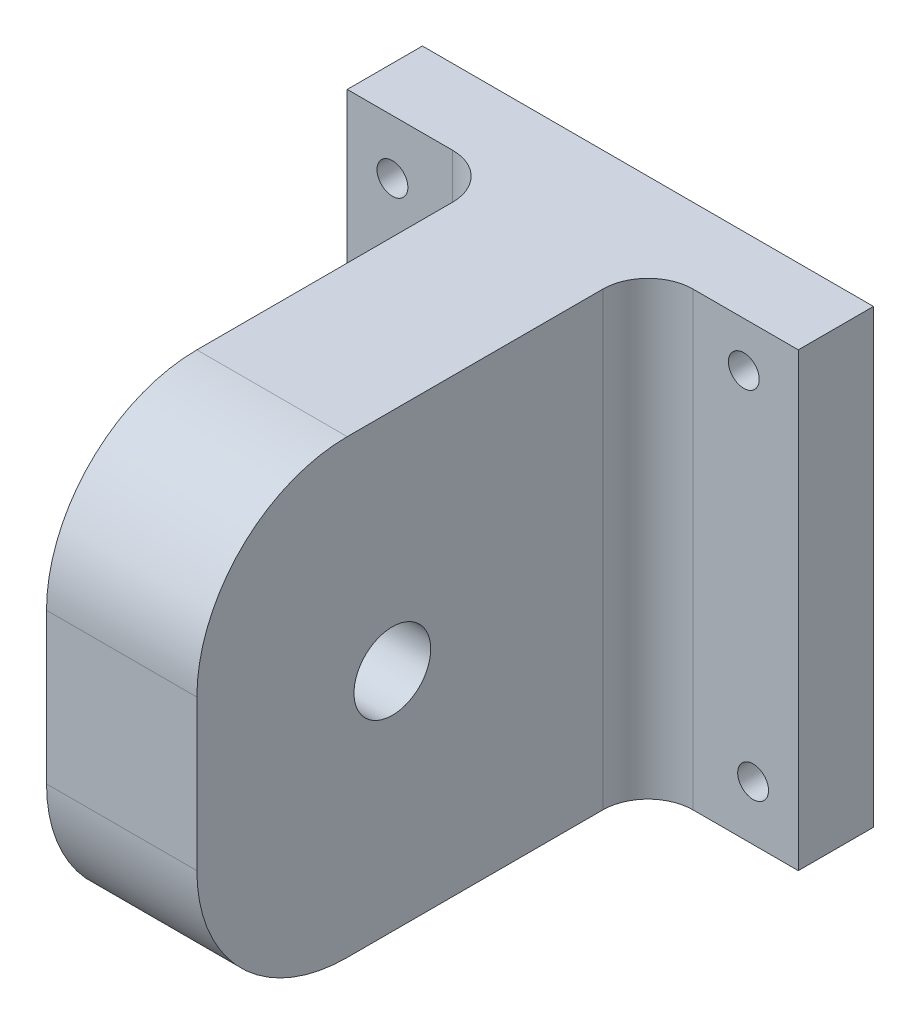
from build123d import *

# Parameters (mm, degrees)
SKETCH1_W           = 30
SKETCH1_H           = 30
BOSS_EXTRUDE2_DEPTH = 5
SKETCH3_R           = 1.02617269
CUT_EXTRUDE1_DEPTH  = 5
SKETCH4_W           = 10
SKETCH4_H           = 30
BOSS_EXTRUDE3_DEPTH = 30
SKETCH5_R           = 2.55
CUT_EXTRUDE2_DEPTH  = 30
FILLET1_R           = 10
FILLET2_R           = 10
FILLET4_R           = 3
FILLET5_R           = 3


with BuildPart() as part:
    # Sketch1 → Boss-Extrude2 (new body)
    with BuildSketch(Plane.XY):
        Rectangle(SKETCH1_W, SKETCH1_H)
    extrude(amount=BOSS_EXTRUDE2_DEPTH)

    # Sketch3 → Cut-Extrude1 (cut)
    with BuildSketch(Plane.XY.offset(5)):
        with Locations((-11.9939671, 11.375061325)):
            Circle(SKETCH3_R)
        with Locations((11.375061325, 11.9939671)):
            Circle(SKETCH3_R)
        with Locations((11.9939671, -11.375061325)):
            Circle(SKETCH3_R)
        with Locations((-11.375061325, -11.9939671)):
            Circle(SKETCH3_R)
    extrude(amount=-CUT_EXTRUDE1_DEPTH, mode=Mode.SUBTRACT)

    # Sketch4 → Boss-Extrude3 (add)
    with BuildSketch(Plane.XY.offset(5)):
        Rectangle(SKETCH4_W, SKETCH4_H)
    extrude(amount=BOSS_EXTRUDE3_DEPTH)

    # Sketch5 → Cut-Extrude2 (cut)
    with BuildSketch(Plane(origin=(5, 0, 0), x_dir=(0, 0, -1), z_dir=(1, 0, 0))):
        with Locations((-22, 0)):
            Circle(SKETCH5_R)
    extrude(amount=-CUT_EXTRUDE2_DEPTH, mode=Mode.SUBTRACT)

    # Fillet1
    fillet1_edges = [part.edges().sort_by_distance(p)[0] for p in [
        (0, -15, 35),
    ]]
    fillet(fillet1_edges, radius=FILLET1_R)

    # Fillet2
    fillet2_edges = [part.edges().sort_by_distance(p)[0] for p in [
        (0, 15, 35),
    ]]
    fillet(fillet2_edges, radius=FILLET2_R)

    # Fillet4
    fillet4_edges = [part.edges().sort_by_distance(p)[0] for p in [
        (5, 0, 5),
    ]]
    fillet(fillet4_edges, radius=FILLET4_R)

    # Fillet5
    fillet5_edges = [part.edges().sort_by_distance(p)[0] for p in [
        (-5, 0, 5),
    ]]
    fillet(fillet5_edges, radius=FILLET5_R)


solid = part.part
